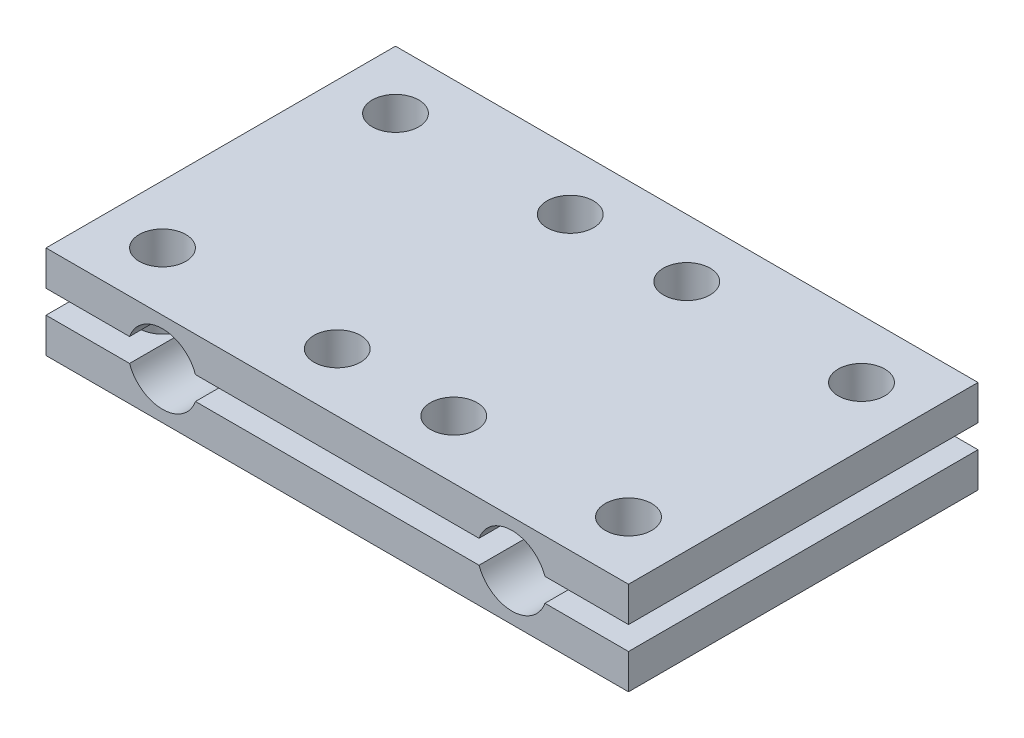
from build123d import *

# Parameters (mm, degrees)
SKETCH_1_W          = 25
SKETCH_1_H          = 30
SKETCH_1_R          = 2
EXTRUDE_1_DEPTH     = 8
SKETCH_2_R          = 3
SKETCH_2_W          = 50
SKETCH_2_H          = 2
CUT_EXTRUDE_1_DEPTH = 40.862262856


with BuildPart() as part:
    # 스케치1 → 보스-돌출1 (new body)
    # profile 1 of 2: a face of its own
    with BuildSketch(Plane(origin=(0, 0, 0), x_dir=(1, 0, 0), z_dir=(0, 1, 0))):
        with Locations((-12.5, 15)):
            Rectangle(SKETCH_1_W, SKETCH_1_H)
        with Locations(Location((-20, 5, 0), (0, 0, 270))):
            Circle(SKETCH_1_R, mode=Mode.SUBTRACT)
        with Locations(Location((-20, 25, 0), (0, 0, 270))):
            Circle(SKETCH_1_R, mode=Mode.SUBTRACT)
        with Locations(Location((-5, 5, 0), (0, 0, 270))):
            Circle(SKETCH_1_R, mode=Mode.SUBTRACT)
        with Locations(Location((-5, 25, 0), (0, 0, 270))):
            Circle(SKETCH_1_R, mode=Mode.SUBTRACT)
    # profile 2 of 2: a face of its own
    with BuildSketch(Plane(origin=(0, 0, 0), x_dir=(1, 0, 0), z_dir=(0, 1, 0))):
        with Locations((12.5, 15)):
            Rectangle(SKETCH_1_W, SKETCH_1_H)
        with Locations(Location((5, 5, 0), (0, 0, 270))):
            Circle(SKETCH_1_R, mode=Mode.SUBTRACT)
        with Locations(Location((5, 25, 0), (0, 0, 270))):
            Circle(SKETCH_1_R, mode=Mode.SUBTRACT)
        with Locations(Location((20, 5, 0), (0, 0, 270))):
            Circle(SKETCH_1_R, mode=Mode.SUBTRACT)
        with Locations(Location((20, 25, 0), (0, 0, 270))):
            Circle(SKETCH_1_R, mode=Mode.SUBTRACT)
    extrude(amount=EXTRUDE_1_DEPTH)

    # 스케치2 → 컷-돌출1 (cut, through all)
    with BuildSketch(Plane.XY):
        with Locations((-15, 4)):
            Circle(SKETCH_2_R)
        with Locations((15, 4)):
            Circle(SKETCH_2_R)
        with Locations((0, 4)):
            Rectangle(SKETCH_2_W, SKETCH_2_H)
    extrude(amount=-CUT_EXTRUDE_1_DEPTH, mode=Mode.SUBTRACT)


with BuildPart() as cut_extrude_1_piece_1:
    # of the separate pieces the step leaves, piece 1, a body of its own (cut_extrude_1_pieces)
    add(part.part.solids().sort_by_distance((-25, 0, 0))[0])


with BuildPart() as cut_extrude_1_piece_2:
    # of the separate pieces the step leaves, piece 2, a body of its own (cut_extrude_1_pieces)
    add(part.part.solids().sort_by_distance((-25, 5, 0))[0])


solid = Compound([cut_extrude_1_piece_1.part, cut_extrude_1_piece_2.part])
